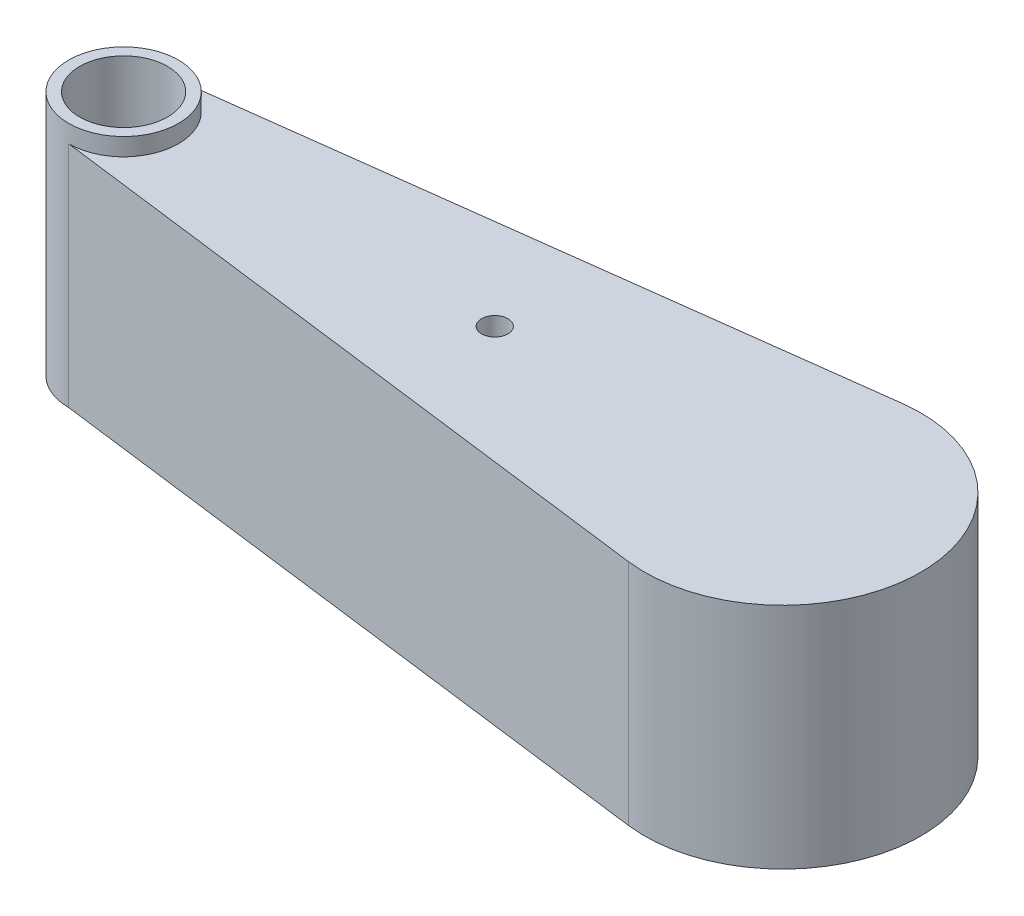
from build123d import *

# Parameters (mm, degrees)
SKETCH1_R           = 5
SKETCH1_R_2         = 1.5
BOSS_EXTRUDE2_DEPTH = 26
SKETCH2_R           = 6.25
BOSS_EXTRUDE3_DEPTH = 2
CUT_EXTRUDE1_START  = -2
SKETCH3_R           = 5
CUT_EXTRUDE1_DEPTH  = 2


with BuildPart() as part:
    # Sketch1 → Boss-Extrude2 (new body)
    with BuildSketch(Plane(origin=(0, 0, 0), x_dir=(1, 0, 0), z_dir=(0, 1, 0))):
        with BuildLine():
            Line((-19.568980619, 0), (53.439105934, 9.332584612))
            ThreePointArc((53.439105934, 9.332584612), (71.14040073, -6.25), (53.439105934, -21.832584612))
            Line((53.439105934, -21.832584612), (-19.568980619, -12.5))
            ThreePointArc((-19.568980619, -12.5), (-25.818980619, -6.25), (-19.568980619, 0))
        make_face()
        with Locations(Location((-19.568980619, -6.25, 0), (0, 0, 90))):
            Circle(SKETCH1_R, mode=Mode.SUBTRACT)
        with Locations(Location((22.660710056, -6.25, 0), (0, 0, 90))):
            Circle(SKETCH1_R_2, mode=Mode.SUBTRACT)
    extrude(amount=BOSS_EXTRUDE2_DEPTH)

    # Sketch2 → Boss-Extrude3 (add)
    with BuildSketch(Plane(origin=(0, 26, 0), x_dir=(1, 0, 0), z_dir=(0, 1, 0))):
        with Locations(Location((-19.568980619, -6.25, 0), (0, 0, 270))):
            Circle(SKETCH2_R)
    extrude(amount=BOSS_EXTRUDE3_DEPTH)

    # Sketch3 → Cut-Extrude1 (cut)
    with BuildSketch(Plane(origin=(0, 28, 0), x_dir=(1, 0, 0), z_dir=(0, 1, 0)).offset(CUT_EXTRUDE1_START)):
        with Locations(Location((-19.568980619, -6.25, 0), (0, 0, 90))):
            Circle(SKETCH3_R)
    extrude(amount=CUT_EXTRUDE1_DEPTH, mode=Mode.SUBTRACT)


solid = part.part
